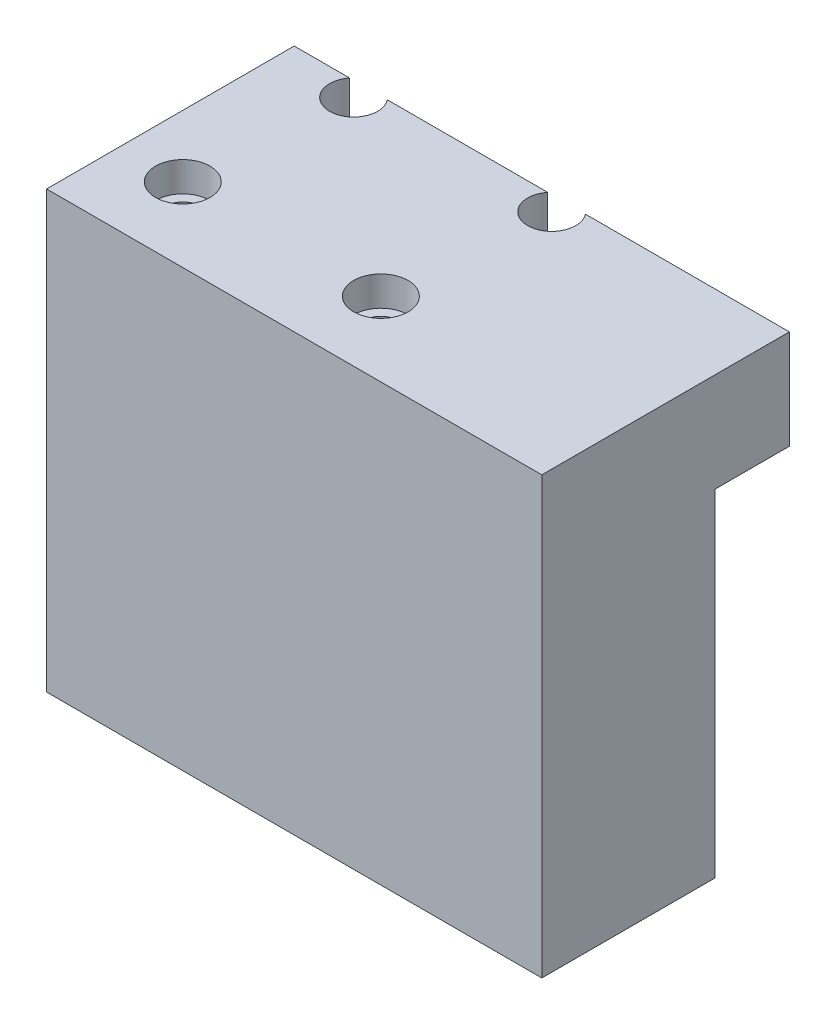
from build123d import *

# Parameters (mm, degrees)
SKETCH_1_W                   = 100
SKETCH_1_H                   = 88
EXTRUDE_1_DEPTH              = 50
SKETCH_2_W                   = 15
SKETCH_2_H                   = 68
CUT_EXTRUDE_1_DEPTH          = 143.281411295
SKETCH_4_R                   = 4.85
CUT_EXTRUDE_3_DEPTH          = 143.281411295
HOLE_WIZARD_M6_1_D           = 7
HOLE_WIZARD_M6_1_CBORE_D     = 11
HOLE_WIZARD_M6_1_CBORE_DEPTH = 6


with BuildPart() as part:
    # 草图1 → 凸台-拉伸1 (new body)
    with BuildSketch(Plane.XY):
        with Locations((50, 44)):
            Rectangle(SKETCH_1_W, SKETCH_1_H)
    extrude(amount=EXTRUDE_1_DEPTH)

    # 草图2 → 切除-拉伸1 (cut, through all)
    with BuildSketch(Plane.ZY):
        with Locations((7.5, 34)):
            Rectangle(SKETCH_2_W, SKETCH_2_H)
    extrude(amount=-CUT_EXTRUDE_1_DEPTH, mode=Mode.SUBTRACT)

    # 草图4 → 切除-拉伸3 (cut, through all)
    with BuildSketch(Plane(origin=(0, 88, 0), x_dir=(1, 0, 0), z_dir=(0, 1, 0))):
        with Locations((15, -3)):
            Circle(SKETCH_4_R)
        with Locations((55, -3)):
            Circle(SKETCH_4_R)
    extrude(amount=-CUT_EXTRUDE_3_DEPTH, mode=Mode.SUBTRACT)

    # M6 六角凹头螺钉的柱形沉头孔1 (through all)
    with Locations(Plane(origin=(0, 88, 0), x_dir=(-1, 0, 0), z_dir=(0, 1, 0))):
        with Locations((-12.5, 35), (-52.5, 35)):
            CounterBoreHole(HOLE_WIZARD_M6_1_D / 2, HOLE_WIZARD_M6_1_CBORE_D / 2, HOLE_WIZARD_M6_1_CBORE_DEPTH)


solid = part.part
